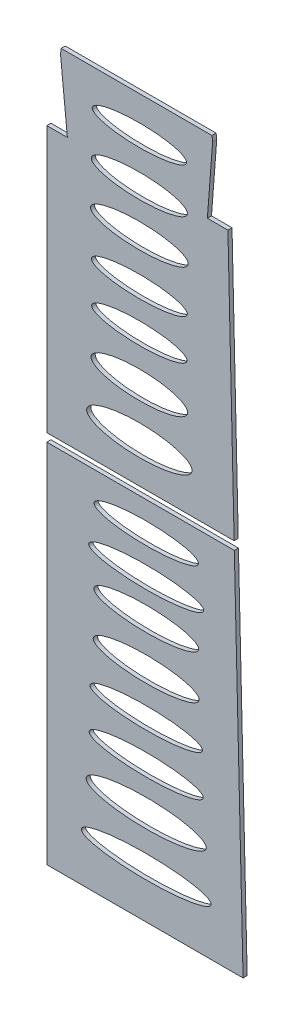
from build123d import *

# Parameters (mm, degrees)
MODEL_RX          = 12.810793527
MODEL_RY          = 3.676944785
MODEL_RX_2        = 11.73547223
MODEL_RY_2        = 3.344158456
MODEL_RX_3        = 11.587591631
MODEL_RY_3        = 2.620371998
MODEL_RX_4        = 11.665285619
MODEL_RY_4        = 2.595913441
MODEL_RX_5        = 11.891821935
MODEL_RY_5        = 3.015935615
MODEL_RX_6        = 11.693519243
MODEL_RY_6        = 2.909465442
MODEL_RX_7        = 11.467552114
MODEL_RY_7        = 2.613646551
EXTRUDE_1_DEPTH   = 1
MODEL_RX_8        = 15.788071885
MODEL_RY_8        = 2.798308389
MODEL_RX_9        = 14.615056558
MODEL_RX_10       = 13.873877308
MODEL_RX_11       = 13.674485311
MODEL_RX_12       = 12.880803494
MODEL_RX_13       = 12.748045597
MODEL_RX_14       = 13.98305321
MODEL_RX_15       = 12.687966957
EXTRUDE_1_2_DEPTH = 1


with BuildPart() as part:
    # Model → 凸台-拉伸1 (new body)
    with BuildSketch(Plane.XY):
        Polygon((838.812318942, 453.365497759), (884.3612651, 453.365497759), (882.852260835, 518.035258225), (877.852260835, 518.035258225), (879.138034268, 534.800409711), (878.975245436, 536.029815694), (842.299167643, 536.029815694), (842.142482059, 534.731315909), (843.812567805, 518.029815692), (838.812567805, 518.029815692), align=None)
        with Locations((861.31300321, 463.03468948)):
            Ellipse(MODEL_RX, MODEL_RY, mode=Mode.SUBTRACT)
        with Locations((861.31300321, 474.696606348)):
            Ellipse(MODEL_RX_2, MODEL_RY_2, mode=Mode.SUBTRACT)
        with Locations((861.31300321, 485.576051895)):
            Ellipse(MODEL_RX_3, MODEL_RY_3, mode=Mode.SUBTRACT)
        with Locations((861.31300321, 495.407135251)):
            Ellipse(MODEL_RX_4, MODEL_RY_4, mode=Mode.SUBTRACT)
        with Locations((861.31300321, 506.096945682)):
            Ellipse(MODEL_RX_5, MODEL_RY_5, mode=Mode.SUBTRACT)
        with Locations((861.31300321, 516.592227033)):
            Ellipse(MODEL_RX_6, MODEL_RY_6, mode=Mode.SUBTRACT)
        with Locations((861.31300321, 527.261411301)):
            Ellipse(MODEL_RX_7, MODEL_RY_7, mode=Mode.SUBTRACT)
    extrude(amount=EXTRUDE_1_DEPTH)


with BuildPart() as body_2:
    # Model → Extrude 1 2 (new body)
    with BuildSketch(Plane.XY):
        Polygon((838.812072799, 362.379421788), (838.812318942, 451.365497759), (884.409069415, 451.365497759), (886.535705871, 362.379421788), align=None)
        with Locations((862.975707439, 374.024304205)):
            Ellipse(MODEL_RX_8, MODEL_RY_8, mode=Mode.SUBTRACT)
        with Locations((862.975707439, 385.32075675)):
            Ellipse(MODEL_RX_9, MODEL_RY_2, mode=Mode.SUBTRACT)
        with Locations((862.975707439, 395.521697164)):
            Ellipse(MODEL_RX_10, MODEL_RY_3, mode=Mode.SUBTRACT)
        with Locations((862.975707439, 405.377239078)):
            Ellipse(MODEL_RX_11, MODEL_RY_4, mode=Mode.SUBTRACT)
        with Locations((862.975707439, 415.647027334)):
            Ellipse(MODEL_RX_12, MODEL_RY_5, mode=Mode.SUBTRACT)
        with Locations((862.975707439, 426.248778858)):
            Ellipse(MODEL_RX_13, MODEL_RY_6, mode=Mode.SUBTRACT)
        with Locations((862.975707439, 434.995178452)):
            Ellipse(MODEL_RX_14, MODEL_RY_7, mode=Mode.SUBTRACT)
        with Locations((862.975707439, 444.248932304)):
            Ellipse(MODEL_RX_15, MODEL_RY_7, mode=Mode.SUBTRACT)
    extrude(amount=EXTRUDE_1_2_DEPTH)


solid = Compound([part.part, body_2.part])
